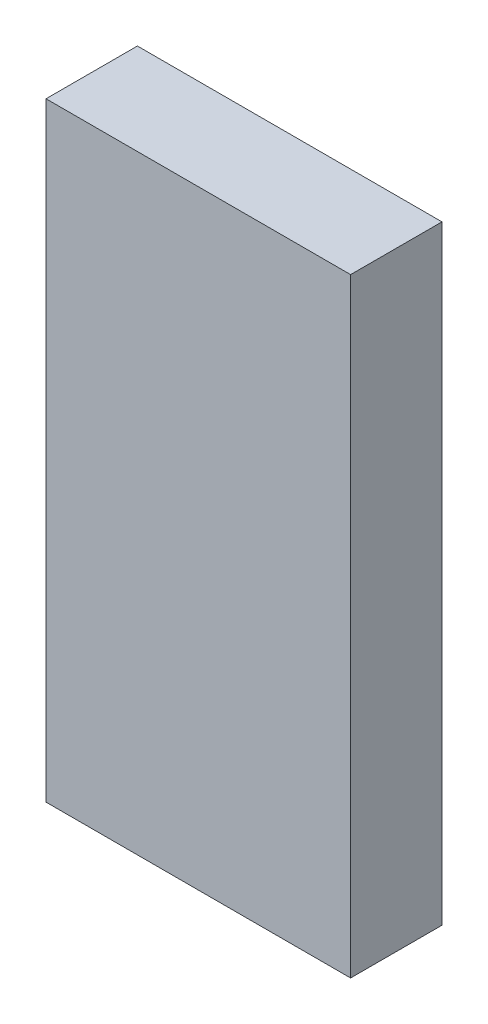
from build123d import *

# Parameters (mm, degrees)
SKETCH1_W           = 10
SKETCH1_H           = 3
BOSS_EXTRUDE1_DEPTH = 20


with BuildPart() as part:
    # Sketch1 → Boss-Extrude1 (new body)
    with BuildSketch(Plane(origin=(0, 0, 0), x_dir=(1, 0, 0), z_dir=(0, 1, 0))):
        Rectangle(SKETCH1_W, SKETCH1_H)
    extrude(amount=BOSS_EXTRUDE1_DEPTH)


solid = part.part
